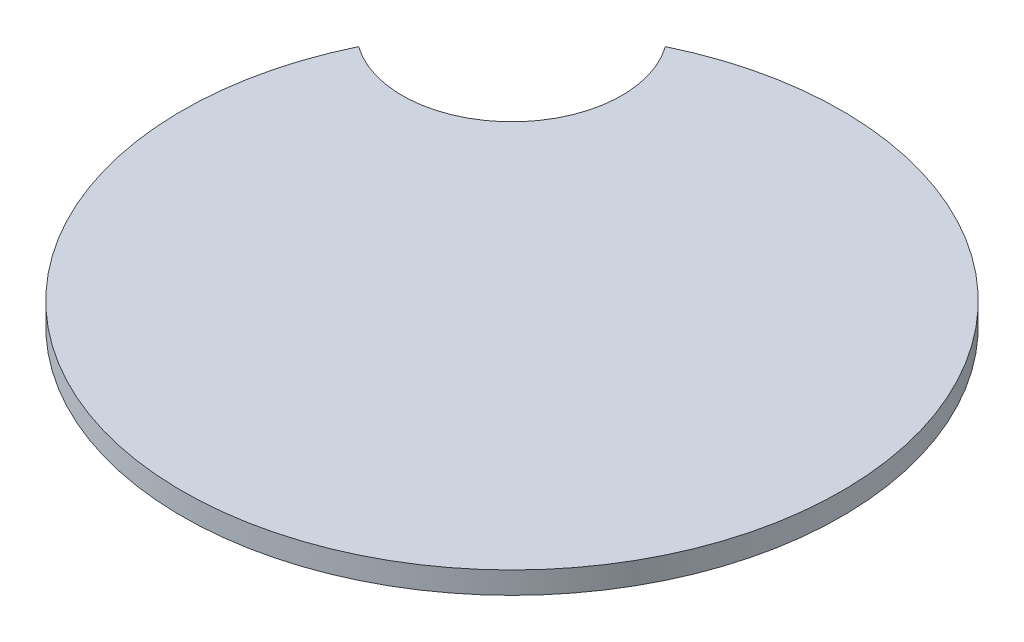
from build123d import *
from build123d.topology import SkipClean

# Parameters (mm, degrees)
SKIZZE1_R                         = 10
AUFSATZ_LINEAR_AUSTRAGEN1_DEPTH   = 2
SKIZZE2_R                         = 30
AUFSATZ_LINEAR_AUSTRAGEN2_DEPTH   = 2
AUFSATZ_LINEAR_AUSTRAGEN3_DEPTH   = 2
AUFSATZ_LINEAR_AUSTRAGEN3_2_DEPTH = 2
SKIZZE4_R                         = 10
AUFSATZ_LINEAR_AUSTRAGEN4_DEPTH   = 2
AUFSATZ_LINEAR_START              = 3
AUFSATZ_LINEAR_AUSTRAGEN15_DEPTH  = 3
SKIZZE9_R                         = 10
SCHNITT_LINEAR_AUSTRAGEN1_DEPTH   = 10
AUFSATZ_LINEAR_AUSTRAGEN16_DEPTH  = 3


with BuildPart() as part:
    # Skizze1 → Aufsatz-Linear austragen1 (new body)
    with BuildSketch(Plane(origin=(0, 0, 0), x_dir=(1, 0, 0), z_dir=(0, 1, 0))):
        with Locations(Location((0, 0, 0), (0, 0, 270))):
            Circle(SKIZZE1_R)
    extrude(amount=-AUFSATZ_LINEAR_AUSTRAGEN1_DEPTH)

    # Skizze2 → Aufsatz-Linear austragen2 (add)
    with BuildSketch(Plane(origin=(0, 0, 0), x_dir=(1, 0, 0), z_dir=(0, 1, 0))):
        with Locations(Location((0, 0, 0), (0, 0, 270))):
            Circle(SKIZZE2_R)
    extrude(amount=AUFSATZ_LINEAR_AUSTRAGEN2_DEPTH)



with BuildPart() as body_2:
    # Skizze3 → Aufsatz-Linear austragen3 (new body)
    with BuildSketch(Plane.XZ.offset(2)):
        with BuildLine():
            Line((-7.071067812, 7.071067812), (-9.192388155, 9.192388155))
            ThreePointArc((-9.192388155, 9.192388155), (-13, 0), (-9.192388155, -9.192388155))
            Line((-9.192388155, -9.192388155), (-7.071067812, -7.071067812))
            ThreePointArc((-7.071067812, -7.071067812), (-10, 0), (-7.071067812, 7.071067812))
        make_face()
    extrude(amount=AUFSATZ_LINEAR_AUSTRAGEN3_DEPTH)


with BuildPart() as body_3:
    # Skizze3 → Aufsatz-Linear austragen3 2 (new body)
    with BuildSketch(Plane.XZ.offset(2)):
        with BuildLine():
            Line((7.071067812, 7.071067812), (9.192388155, 9.192388155))
            ThreePointArc((9.192388155, 9.192388155), (13, 0), (9.192388155, -9.192388155))
            Line((9.192388155, -9.192388155), (7.071067812, -7.071067812))
            ThreePointArc((7.071067812, -7.071067812), (10, 0), (7.071067812, 7.071067812))
        make_face()
    extrude(amount=AUFSATZ_LINEAR_AUSTRAGEN3_2_DEPTH)


with BuildPart() as part_1:
    add(part.part)

    add(body_2.part)  # Aufsatz-Linear austragen4 merges body 2

    add(body_3.part)  # Aufsatz-Linear austragen4 merges body 3
    # Skizze4 → Aufsatz-Linear austragen4 (add)
    with BuildSketch(Plane.XZ.offset(2)):
        with Locations(Location((0, 0, 0), (0, 0, 90))):
            Circle(SKIZZE4_R)
    extrude(amount=AUFSATZ_LINEAR_AUSTRAGEN4_DEPTH)

    # Skizze8 → Aufsatz-Linear austragen15 (add)
    with BuildSketch(Plane(origin=(0, -2, 0), x_dir=(1, 0, 0), z_dir=(0, 1, 0)).offset(AUFSATZ_LINEAR_START)):
        with BuildLine():
            Line((10.076521944, -8.213629254), (7.737557516, -6.334840462))
            ThreePointArc((7.737557516, -6.334840462), (7.413457608, -6.711232845), (7.071067812, -7.071067812))
            Line((7.071067812, -7.071067812), (9.192388155, -9.192388155))
            ThreePointArc((9.192388155, -9.192388155), (9.646875989, -8.714228804), (10.076521944, -8.213629254))
        make_face()
        with BuildLine():
            Line((-7.071067812, 7.071067812), (-9.192388155, 9.192388155))
            ThreePointArc((-9.192388155, 9.192388155), (-9.636776415, 8.725396284), (-10.057468336, 8.236949111))
            Line((-10.057468336, 8.236949111), (-7.732766819, 6.340687449))
            ThreePointArc((-7.732766819, 6.340687449), (-7.410920578, 6.714034271), (-7.071067812, 7.071067812))
        make_face()
    extrude(amount=-AUFSATZ_LINEAR_AUSTRAGEN15_DEPTH)

    # Skizze9 → Schnitt-Linear austragen1 (cut)
    with BuildSketch(Plane.XZ):
        with Locations((-21.176717953, -21.176717953)):
            Circle(SKIZZE9_R)
    extrude(amount=-SCHNITT_LINEAR_AUSTRAGEN1_DEPTH, mode=Mode.SUBTRACT)

    # Skizze10 → Aufsatz-Linear austragen16 (add)
    with SkipClean():  # the faces are left unmerged after this step: merging them gives an invalid solid
        with BuildSketch(Plane.XZ):
            with BuildLine():
                Line((12.75, 0), (13, 0))
                ThreePointArc((13, 0), (12.612939215, 3.148613086), (11.474805482, 6.109733149))
                Line((11.474805482, 6.109733149), (11.250587553, 5.998898209))
                ThreePointArc((11.250587553, 5.998898209), (12.369468285, 3.091723524), (12.75, 0))
            make_face()
            with BuildLine():
                Line((9.53531372, -8.464058852), (9.730797288, -8.620416703))
                ThreePointArc((9.730797288, -8.620416703), (11.761619744, -5.537535643), (12.843968796, -2.008099992))
                Line((12.843968796, -2.008099992), (12.596380081, -1.973248299))
                ThreePointArc((12.596380081, -1.973248299), (11.531939258, -5.438462739), (9.53531372, -8.464058852))
            make_face()
            with BuildLine():
                Line((-12.731858626, -0.017690555), (-12.981862864, -0.017690555))
                ThreePointArc((-12.981862864, -0.017690555), (-12.594944508, -3.166086381), (-11.45802615, -6.127423703))
                Line((-11.45802615, -6.127423703), (-11.233808221, -6.016588763))
                ThreePointArc((-11.233808221, -6.016588763), (-12.351470245, -3.109195987), (-12.731858626, -0.017690555))
            make_face()
            with BuildLine():
                Line((-9.526622279, 8.457212783), (-9.72209655, 8.613563198))
                ThreePointArc((-9.72209655, 8.613563198), (-11.751242737, 5.529465141), (-12.833641797, 1.999945719))
                Line((-12.833641797, 1.999945719), (-12.586053082, 1.965094027))
                ThreePointArc((-12.586053082, 1.965094027), (-11.521565497, 5.430393435), (-9.526622279, 8.457212783))
            make_face()
        extrude(amount=AUFSATZ_LINEAR_AUSTRAGEN16_DEPTH)


solid = part_1.part
